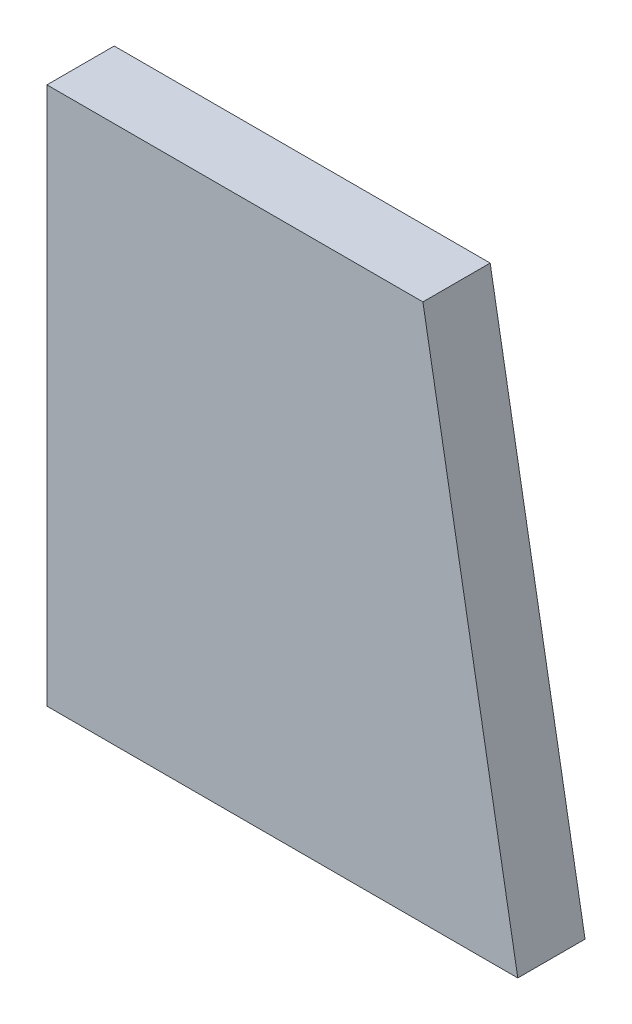
from build123d import *

# Parameters (mm, degrees)
BOSS_EXTRU_1_DEPTH = 5


with BuildPart() as part:
    # Esquisse1 → Boss.-Extru.1 (new body)
    with BuildSketch(Plane.XY):
        Polygon((0, 0), (-35, 0), (-35, 40), (-7.053079228, 40), align=None)
    extrude(amount=BOSS_EXTRU_1_DEPTH)


solid = part.part
